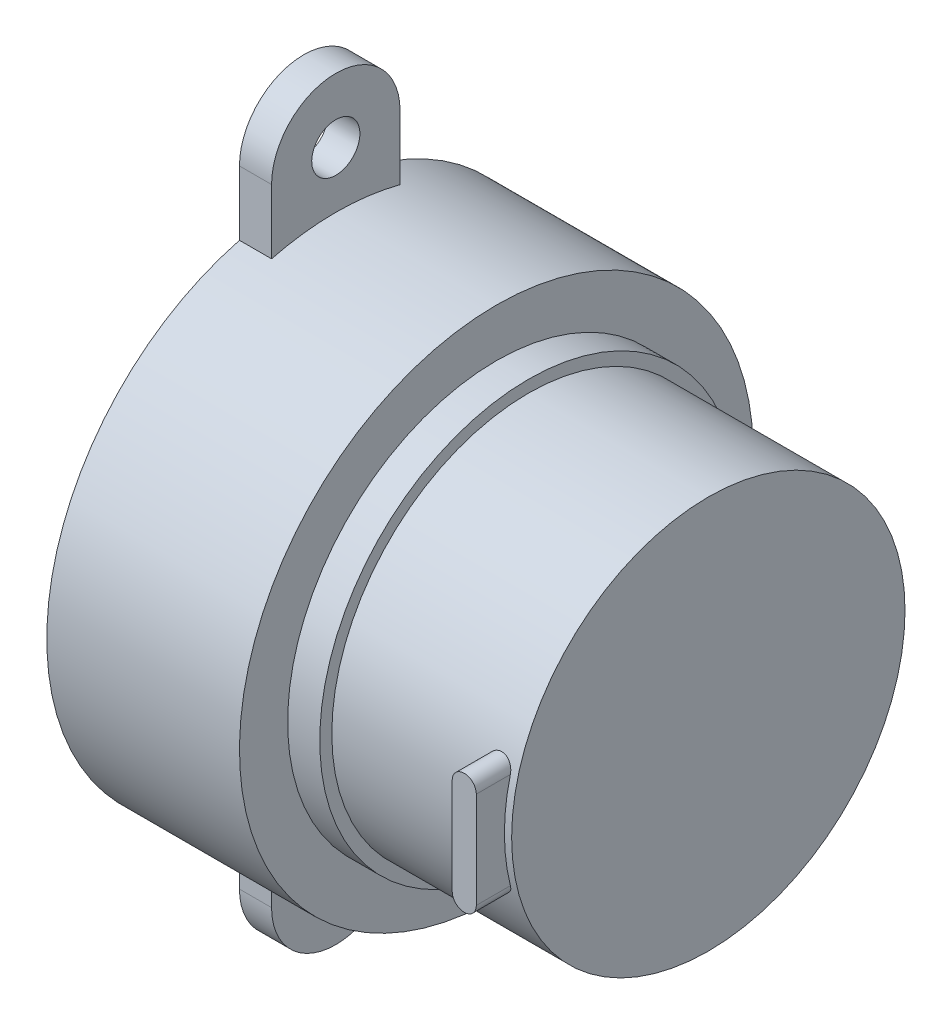
from build123d import *

# Parameters (mm, degrees)
SKETCH_2_R             = 1.5
EXTRUDE_1_DEPTH        = 2
HOLE_WIZARD_M3_2_D     = 2.5
HOLE_WIZARD_M3_2_DEPTH = 6
HOLE_WIZARD_M3_2_TIP   = 0.751075774
CUT_EXTRUDE_1_DEPTH    = 5
EXTRUDE_2_DEPTH        = 14


with BuildPart() as part:
    # 草图1 → 旋转1 (revolve)
    with BuildSketch(Plane.XY):
        Polygon((0, 0), (0, 16), (12, 16), (12, 13), (14, 13), (14, 12.25), (25.2, 12.25), (25.2, 0), align=None)
    revolve(axis=Axis((25.2, 0, 0), (-1, 0, 0)))

    # 草图2 → 凸台-拉伸1 (add)
    with BuildSketch(Plane.ZY):
        with BuildLine():
            Line((4, 19.5), (4, -19.5))
            ThreePointArc((4, -19.5), (0, -23.5), (-4, -19.5))
            Line((-4, -19.5), (-4, 19.5))
            ThreePointArc((-4, 19.5), (0, 23.5), (4, 19.5))
        make_face()
        with Locations(Location((0, 19.5, 0), (0, 0, 270))):
            Circle(SKETCH_2_R, mode=Mode.SUBTRACT)
        with Locations(Location((0, -19.5, 0), (0, 0, 270))):
            Circle(SKETCH_2_R, mode=Mode.SUBTRACT)
    extrude(amount=-EXTRUDE_1_DEPTH)

    # 草图4 → 旋转2 (revolve)
    with BuildSketch(Plane.XY.offset(-8), mode=Mode.PRIVATE) as revolve_2_sk:
        Polygon((0, 0), (0, 4.25), (-0.5, 4.25), (-0.5, 4), (-2.7, 4), (-2.7, 2.5), (-10.2, 2.5), (-10.2, 0), align=None)
    revolve(revolve_2_sk.sketch.rotate(Axis((-10.2, 0, -8), (1, 0, 0)), 180), axis=Axis((-10.2, 0, -8), (1, 0, 0)))

    # M3 螺纹孔2
    with Locations(Plane.ZY.offset(10.2)):
        with Locations((-8, 0)):
            Hole(HOLE_WIZARD_M3_2_D / 2, depth=HOLE_WIZARD_M3_2_DEPTH)
            with Locations((0, 0, -(HOLE_WIZARD_M3_2_DEPTH + HOLE_WIZARD_M3_2_TIP / 2))):  # 118° drill point
                Cone(0, HOLE_WIZARD_M3_2_D / 2, HOLE_WIZARD_M3_2_TIP, mode=Mode.SUBTRACT)

    # 草图5 → 切除-拉伸1 (cut)
    with BuildSketch(Plane.ZY.offset(10.2)):
        with BuildLine():
            Line((-10, -1.5), (-10, 1.5))
            ThreePointArc((-10, 1.5), (-10.5, 0), (-10, -1.5))
        make_face()
        with BuildLine():
            ThreePointArc((-5.5, 0), (-5.628291755, 0.790569415), (-6, 1.5))
            Line((-6, 1.5), (-6, -1.5))
            ThreePointArc((-6, -1.5), (-5.628291755, -0.790569415), (-5.5, 0))
        make_face()
    extrude(amount=-CUT_EXTRUDE_1_DEPTH, mode=Mode.SUBTRACT)

    # 草图9 → 凸台-拉伸2 (add)
    with BuildSketch(Plane.XY):
        with BuildLine():
            Line((24.75, 2.995850319), (24.75, -3.004149681))
            ThreePointArc((24.75, -3.004149681), (24, -3.754149681), (23.25, -3.004149681))
            Line((23.25, -3.004149681), (23.25, 2.995850319))
            ThreePointArc((23.25, 2.995850319), (24, 3.745850319), (24.75, 2.995850319))
        make_face()
    extrude(amount=EXTRUDE_2_DEPTH)


solid = part.part
